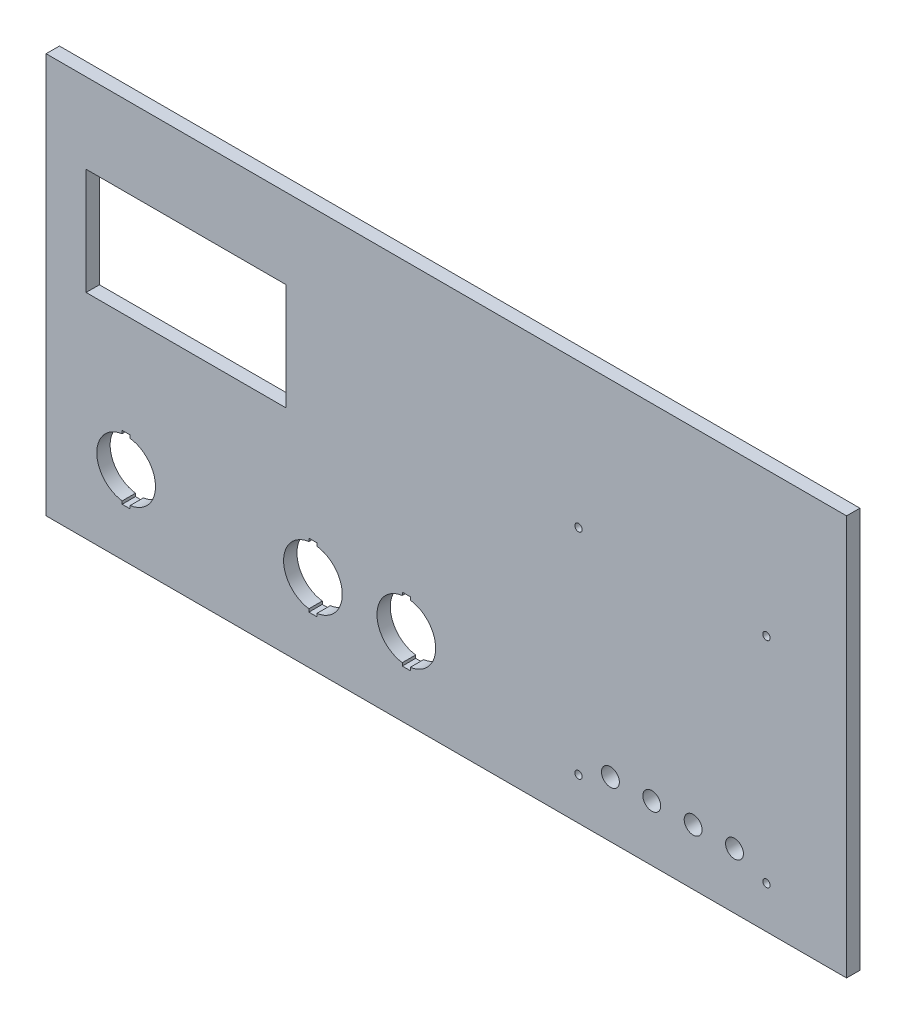
from build123d import *

# Parameters (mm, degrees)
SKIZZE1_W                       = 300
SKIZZE1_H                       = 150
AUFSATZ_LINEAR_AUSTRAGEN1_DEPTH = 5
SKIZZE3_W                       = 75
SKIZZE3_H                       = 40
SCHNITT_LINEAR_AUSTRAGEN2_DEPTH = 168.779617356
SKIZZE5_R                       = 11
SKIZZE5_W                       = 3
SKIZZE5_H                       = 24
SCHNITT_LINEAR_AUSTRAGEN4_DEPTH = 168.779617356
SKIZZE2_R                       = 1.375
SKIZZE2_R_2                     = 3.35
SCHNITT_LINEAR_AUSTRAGEN5_DEPTH = 168.779617356


with BuildPart() as part:
    # Skizze1 → Aufsatz-Linear austragen1 (new body)
    with BuildSketch(Plane.XY):
        Rectangle(SKIZZE1_W, SKIZZE1_H)
    extrude(amount=AUFSATZ_LINEAR_AUSTRAGEN1_DEPTH)

    # Skizze3 → Schnitt-Linear austragen2 (cut, through all)
    with BuildSketch(Plane.XY.offset(5)):
        with Locations((-97.5, 25)):
            Rectangle(SKIZZE3_W, SKIZZE3_H)
    extrude(amount=-SCHNITT_LINEAR_AUSTRAGEN2_DEPTH, mode=Mode.SUBTRACT)

    # Skizze5 → Schnitt-Linear austragen4 (cut, through all)
    with BuildSketch(Plane.XY.offset(5)):
        with Locations((-15, -45)):
            Circle(SKIZZE5_R)
        with Locations((-50, -45)):
            Circle(SKIZZE5_R)
        with Locations((-120, -45)):
            Circle(SKIZZE5_R)
        with Locations((-15, -45)):
            Rectangle(SKIZZE5_W, SKIZZE5_H)
        with Locations((-50, -45)):
            Rectangle(SKIZZE5_W, SKIZZE5_H)
        with Locations((-120, -45)):
            Rectangle(SKIZZE5_W, SKIZZE5_H)
    extrude(amount=-SCHNITT_LINEAR_AUSTRAGEN4_DEPTH, mode=Mode.SUBTRACT)

    # Skizze2 → Schnitt-Linear austragen5 (cut, through all)
    with BuildSketch(Plane.XY.offset(5)):
        with Locations((49.537329599, 20.961824544)):
            Circle(SKIZZE2_R)
        with Locations((119.962670401, 20.961824544)):
            Circle(SKIZZE2_R)
        with Locations((119.962670401, -59.261824544)):
            Circle(SKIZZE2_R)
        with Locations((49.537329599, -59.261824544)):
            Circle(SKIZZE2_R)
        with Locations((61.5, -54)):
            Circle(SKIZZE2_R_2)
        with Locations((77, -54)):
            Circle(SKIZZE2_R_2)
        with Locations((92.5, -54)):
            Circle(SKIZZE2_R_2)
        with Locations((108, -54)):
            Circle(SKIZZE2_R_2)
    extrude(amount=-SCHNITT_LINEAR_AUSTRAGEN5_DEPTH, mode=Mode.SUBTRACT)


solid = part.part
